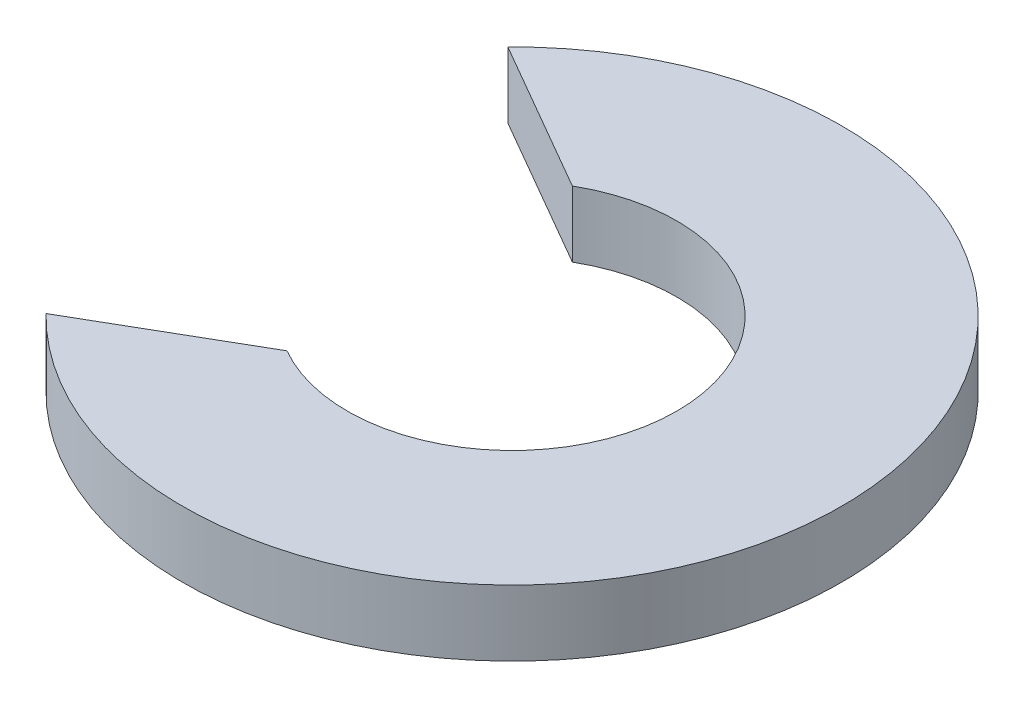
from build123d import *

# Parameters (mm, degrees)
EXTRUDE_1_DEPTH = 0.8


with BuildPart() as part:
    # 草图1 → 凸台-拉伸1 (new body)
    with BuildSketch(Plane(origin=(0, 0, 0), x_dir=(1, 0, 0), z_dir=(0, 1, 0))):
        with BuildLine():
            Line((-1, 1.732050808), (-2.854101966, 2.802517077))
            ThreePointArc((-2.854101966, 2.802517077), (4, 0), (-2.854101966, -2.802517077))
            Line((-2.854101966, -2.802517077), (-1, -1.732050808))
            ThreePointArc((-1, -1.732050808), (2, 0), (-1, 1.732050808))
        make_face()
    extrude(amount=EXTRUDE_1_DEPTH)


solid = part.part
